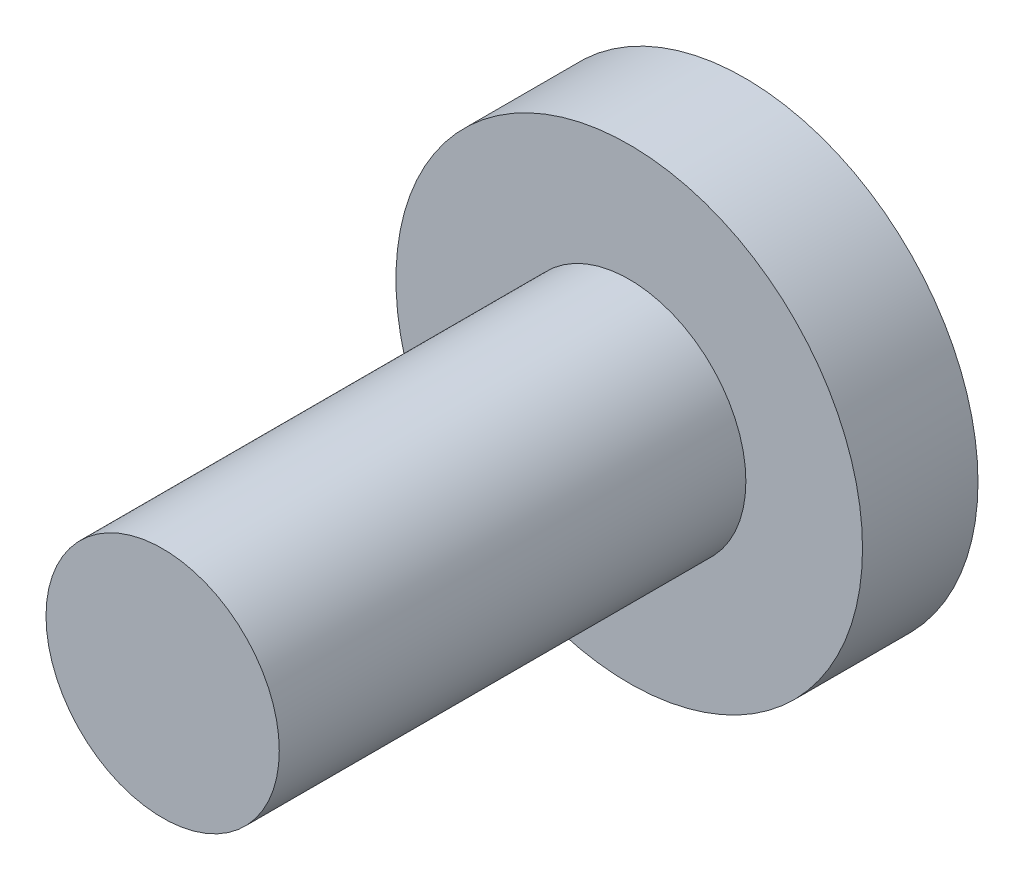
from build123d import *

# Parameters (mm, degrees)
SKETCH1_R           = 101.6
BOSS_EXTRUDE1_DEPTH = 50.292
SKETCH2_R           = 50.8
BOSS_EXTRUDE2_DEPTH = 203.2


with BuildPart() as part:
    # Sketch1 → Boss-Extrude1 (new body)
    with BuildSketch(Plane.XY):
        Circle(SKETCH1_R)
    extrude(amount=BOSS_EXTRUDE1_DEPTH)

    # Sketch2 → Boss-Extrude2 (add)
    with BuildSketch(Plane.XY.offset(50.292)):
        Circle(SKETCH2_R)
    extrude(amount=BOSS_EXTRUDE2_DEPTH)


solid = part.part
